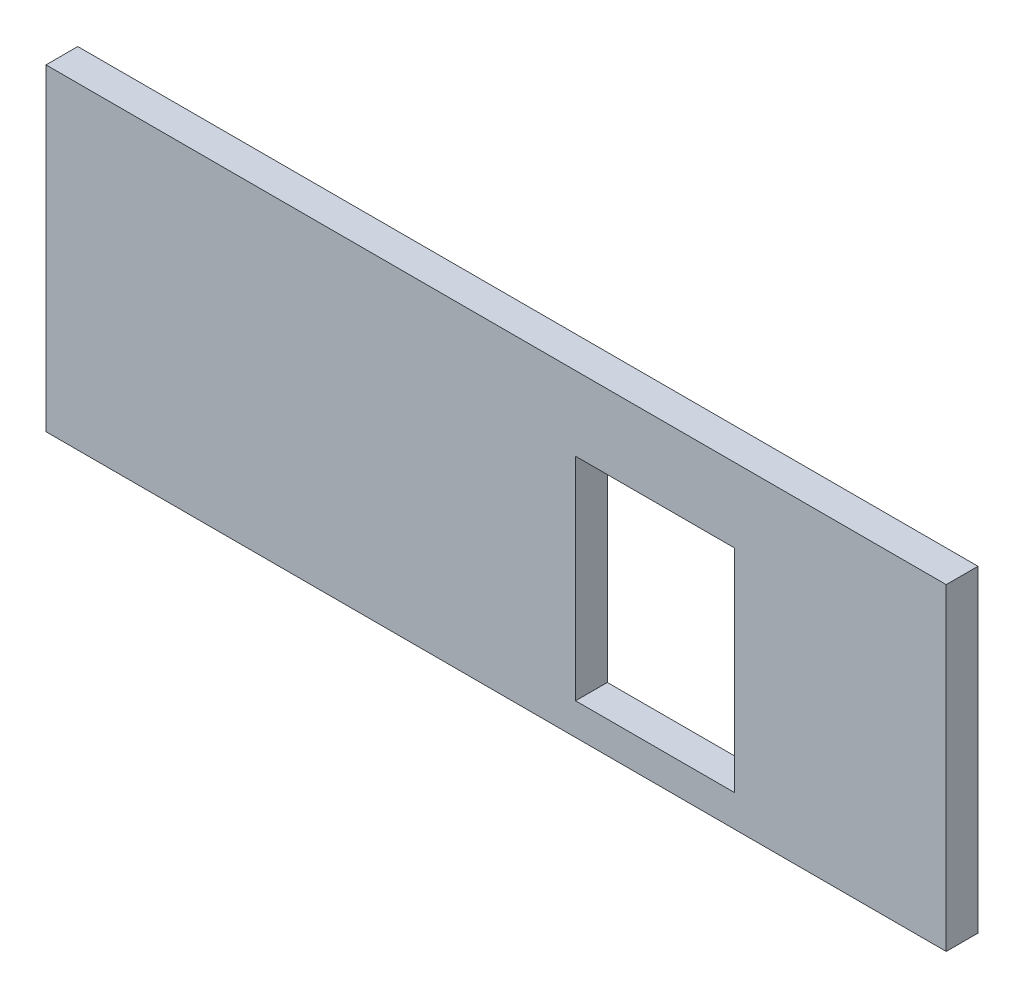
from build123d import *

# Parameters (mm, degrees)
SKETCH1_W           = 170
SKETCH1_H           = 60
BOSS_EXTRUDE1_DEPTH = 6
SKETCH2_W           = 30
SKETCH2_H           = 40
CUT_EXTRUDE1_DEPTH  = 181.377382174


with BuildPart() as part:
    # Sketch1 → Boss-Extrude1 (new body)
    with BuildSketch(Plane.XY):
        with Locations((85, 30)):
            Rectangle(SKETCH1_W, SKETCH1_H)
    extrude(amount=BOSS_EXTRUDE1_DEPTH)

    # Sketch2 → Cut-Extrude1 (cut, through all)
    with BuildSketch(Plane.XY.offset(6)):
        with Locations((115, 26)):
            Rectangle(SKETCH2_W, SKETCH2_H)
    extrude(amount=-CUT_EXTRUDE1_DEPTH, mode=Mode.SUBTRACT)


solid = part.part
